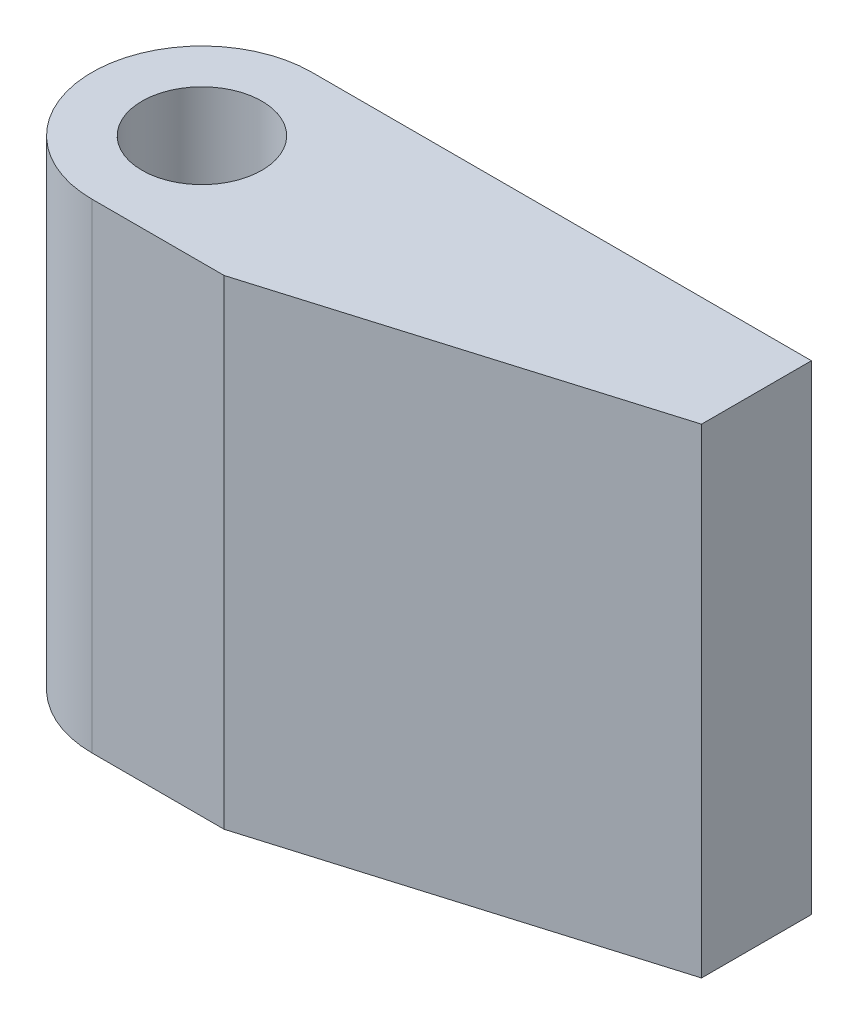
from build123d import *

# Parameters (mm, degrees)
BOSS_EXTRUDE1_DEPTH      = 5
BOSS_EXTRUDE1_DEPTH_BACK = 5
SKETCH3_R                = 1.2
CUT_EXTRUDE1_DEPTH       = 10
SKETCH4_W                = 13.374580466
SKETCH4_H                = 4.798064452
CUT_EXTRUDE2_DEPTH       = 0.2
CUT_EXTRUDE3_DEPTH       = 10


with BuildPart() as part:
    # Sketch2 → Boss-Extrude1 (new, two sides: drawn at the far end of the back side and taken through both)
    with BuildSketch(Plane(origin=(0, 0, 0), x_dir=(1, 0, 0), z_dir=(0, 1, 0)).offset(-BOSS_EXTRUDE1_DEPTH_BACK)):
        with BuildLine():
            Line((0, 2.2), (10, 2.2))
            Line((10, 2.2), (10, -2.2))
            Line((10, -2.2), (0, -2.2))
            ThreePointArc((0, -2.2), (-2.2, 0), (0, 2.2))
        make_face()
    extrude(amount=BOSS_EXTRUDE1_DEPTH + BOSS_EXTRUDE1_DEPTH_BACK)

    # Sketch3 → Cut-Extrude1 (cut)
    with BuildSketch(Plane(origin=(0, 5, 0), x_dir=(1, 0, 0), z_dir=(0, 1, 0))):
        Circle(SKETCH3_R)
    extrude(amount=-CUT_EXTRUDE1_DEPTH, mode=Mode.SUBTRACT)

    # Sketch4 → Cut-Extrude2 (cut)
    with BuildSketch(Plane.XZ.offset(5)):
        with Locations((3.312709767, -0.199032226)):
            Rectangle(SKETCH4_W, SKETCH4_H)
    cut_extrude2 = extrude(amount=-CUT_EXTRUDE2_DEPTH, mode=Mode.SUBTRACT)

    # Mirror1: Cut-Extrude2 across plane
    add(cut_extrude2.mirror(Plane.ZX), mode=Mode.SUBTRACT)

    # Sketch5 → Cut-Extrude3 (cut)
    with BuildSketch(Plane(origin=(0, 4.8, 0), x_dir=(1, 0, 0), z_dir=(0, 1, 0))):
        Polygon((2.645324972, -2.2), (10, 0), (10, -2.2), align=None)
    extrude(amount=-CUT_EXTRUDE3_DEPTH, mode=Mode.SUBTRACT)


solid = part.part
